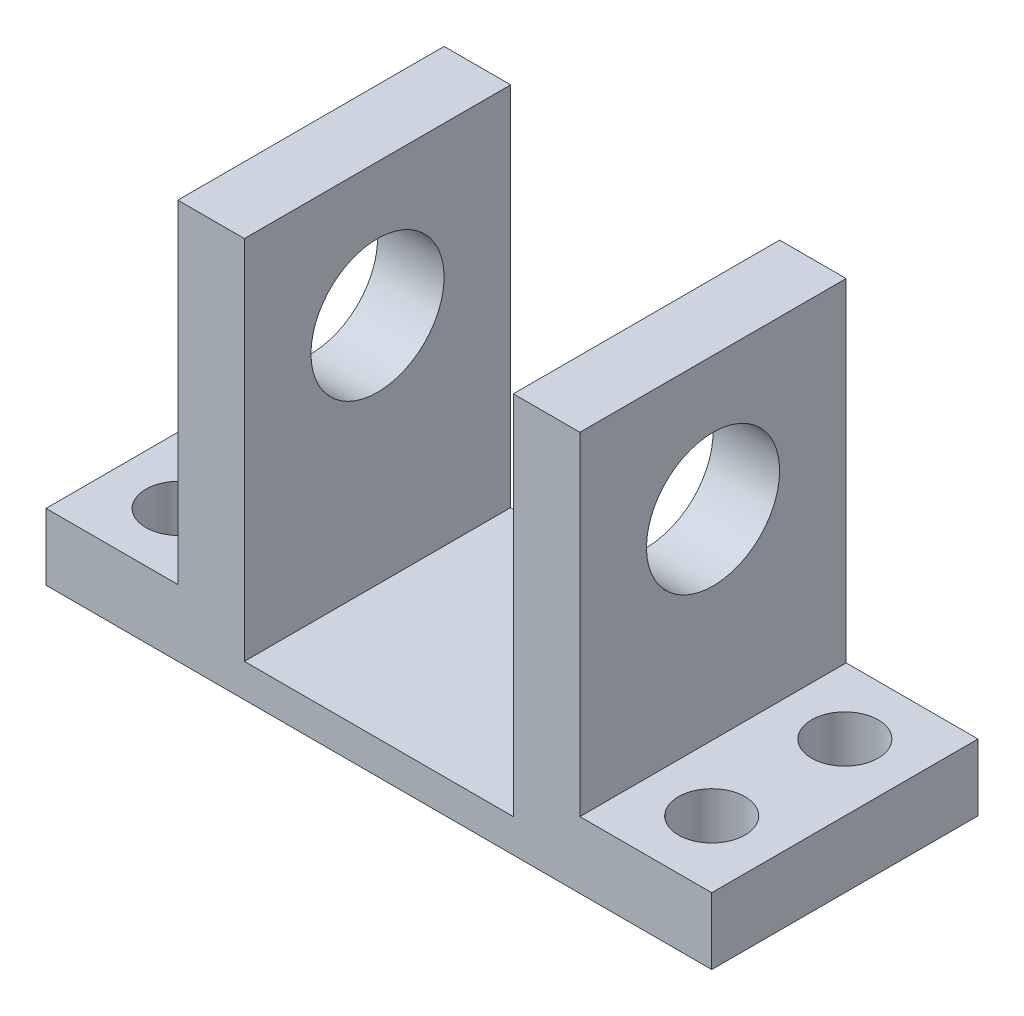
from build123d import *
from build123d.topology import SkipClean

# Parameters (mm, degrees)
SKETCH2_W                       = 6.35
SKETCH2_H                       = 25.4
BOSS_EXTRUDE1_DEPTH             = 38.1
BOSS_EXTRUDE1_2_DEPTH           = 38.1
SKETCH2_3_W                     = 25.4
SKETCH2_3_H                     = 25.4
BOSS_EXTRUDE2_DEPTH             = 3.175
SKETCH3_R                       = 6.35
CUT_EXTRUDE1_DEPTH              = 60.56828015
SKETCH4_W                       = 25.4
SKETCH4_H                       = 6.35
BOSS_EXTRUDE3_DEPTH             = 12.7
SKETCH9_W                       = 25.4
SKETCH9_H                       = 6.35
BOSS_EXTRUDE5_DEPTH             = 12.7
F_1_4_0_25_DIAMETER_HOLE1_D     = 6.35
F_1_4_0_25_DIAMETER_HOLE1_DEPTH = 25.4
F_1_4_0_25_DIAMETER_HOLE1_TIP   = 1.907732465
CUT_EXTRUDE2_START              = -0.127
SKETCH13_W                      = 25.4
SKETCH13_H                      = 34.925
SKETCH13_R                      = 6.35
CUT_EXTRUDE2_DEPTH              = 0.127
SKETCH14_W                      = 25.4
SKETCH14_H                      = 34.925
SKETCH14_R                      = 6.35
CUT_EXTRUDE3_DEPTH              = 0.127
SKETCH16_W                      = 25.4
SKETCH16_H                      = 31.75
SKETCH16_R                      = 6.35
BOSS_EXTRUDE8_DEPTH             = 0.127
BOSS_EXTRUDE9_START             = 0.127
SKETCH15_W                      = 25.4
SKETCH15_H                      = 31.75
SKETCH15_R                      = 6.35
BOSS_EXTRUDE9_DEPTH             = 0.127


with BuildPart() as part:
    # Sketch2 → Boss-Extrude1 (new body)
    with BuildSketch(Plane(origin=(0, 0, 0), x_dir=(1, 0, 0), z_dir=(0, 1, 0))):
        with Locations((3.175, 12.7)):
            Rectangle(SKETCH2_W, SKETCH2_H)
    extrude(amount=BOSS_EXTRUDE1_DEPTH)



with BuildPart() as body_2:
    # Sketch2 → Boss-Extrude1 2 (new body)
    with BuildSketch(Plane(origin=(0, 0, 0), x_dir=(1, 0, 0), z_dir=(0, 1, 0))):
        with Locations((34.925, 12.7)):
            Rectangle(SKETCH2_W, SKETCH2_H)
    extrude(amount=BOSS_EXTRUDE1_2_DEPTH)


with BuildPart() as part_1:
    add(part.part)

    add(body_2.part)  # Boss-Extrude2 merges body 2
    # Sketch2<3> → Boss-Extrude2 (add)
    with BuildSketch(Plane(origin=(0, 0, 0), x_dir=(1, 0, 0), z_dir=(0, 1, 0))):
        with Locations((19.05, 12.7)):
            Rectangle(SKETCH2_3_W, SKETCH2_3_H)
    extrude(amount=BOSS_EXTRUDE2_DEPTH)

    # Sketch3 → Cut-Extrude1 (cut, through all)
    with BuildSketch(Plane.ZY):
        with Locations((-12.7, 25.4)):
            Circle(SKETCH3_R)
    extrude(amount=-CUT_EXTRUDE1_DEPTH, mode=Mode.SUBTRACT)

    # Sketch4 → Boss-Extrude3 (add)
    with BuildSketch(Plane.ZY):
        with Locations((-12.7, 3.175)):
            Rectangle(SKETCH4_W, SKETCH4_H)
    extrude(amount=BOSS_EXTRUDE3_DEPTH)

    # Sketch9 → Boss-Extrude5 (add)
    with BuildSketch(Plane(origin=(38.1, 0, 0), x_dir=(0, 0, -1), z_dir=(1, 0, 0))):
        with Locations((12.7, 3.175)):
            Rectangle(SKETCH9_W, SKETCH9_H)
    extrude(amount=BOSS_EXTRUDE5_DEPTH)

    # 1/4 (0.25) Diameter Hole1
    with Locations(Plane(origin=(-6.35, 6.35, -19.05), x_dir=(0, 0, 1), z_dir=(0, 1, 0))):
        with Locations((0, 0), (12.7, 0), (12.7, 50.8), (0, 50.8)):
            Hole(F_1_4_0_25_DIAMETER_HOLE1_D / 2, depth=F_1_4_0_25_DIAMETER_HOLE1_DEPTH)
            with Locations((0, 0, -(F_1_4_0_25_DIAMETER_HOLE1_DEPTH + F_1_4_0_25_DIAMETER_HOLE1_TIP / 2))):  # 118° drill point
                Cone(0, F_1_4_0_25_DIAMETER_HOLE1_D / 2, F_1_4_0_25_DIAMETER_HOLE1_TIP, mode=Mode.SUBTRACT)

    # Sketch13 → Cut-Extrude2 (cut)
    with BuildSketch(Plane(origin=(6.35, 0, 0), x_dir=(0, 0, -1), z_dir=(1, 0, 0)).offset(CUT_EXTRUDE2_START)):
        with Locations((12.7, 20.6375)):
            Rectangle(SKETCH13_W, SKETCH13_H)
        with Locations((12.7, 25.4)):
            Circle(SKETCH13_R, mode=Mode.SUBTRACT)
    extrude(amount=CUT_EXTRUDE2_DEPTH, mode=Mode.SUBTRACT)

    # Sketch14 → Cut-Extrude3 (cut)
    with BuildSketch(Plane.ZY.offset(-31.75)):
        with Locations((-12.7, 20.6375)):
            Rectangle(SKETCH14_W, SKETCH14_H)
        with Locations((-12.7, 25.4)):
            Circle(SKETCH14_R, mode=Mode.SUBTRACT)
    extrude(amount=-CUT_EXTRUDE3_DEPTH, mode=Mode.SUBTRACT)

    # Sketch16 → Boss-Extrude8 (add)
    with SkipClean():  # the faces are left unmerged after this step: merging them gives an invalid solid
        with BuildSketch(Plane(origin=(38.1, 0, 0), x_dir=(0, 0, -1), z_dir=(1, 0, 0))):
            with Locations((12.7, 22.225)):
                Rectangle(SKETCH16_W, SKETCH16_H)
            with Locations((12.7, 25.4)):
                Circle(SKETCH16_R, mode=Mode.SUBTRACT)
        extrude(amount=BOSS_EXTRUDE8_DEPTH)

    # Sketch15 → Boss-Extrude9 (add)
    with SkipClean():  # the faces are left unmerged after this step: merging them gives an invalid solid
        with BuildSketch(Plane.ZY.offset(BOSS_EXTRUDE9_START)):
            with Locations((-12.7, 22.225)):
                Rectangle(SKETCH15_W, SKETCH15_H)
            with Locations((-12.7, 25.4)):
                Circle(SKETCH15_R, mode=Mode.SUBTRACT)
        extrude(amount=-BOSS_EXTRUDE9_DEPTH)


solid = part_1.part
